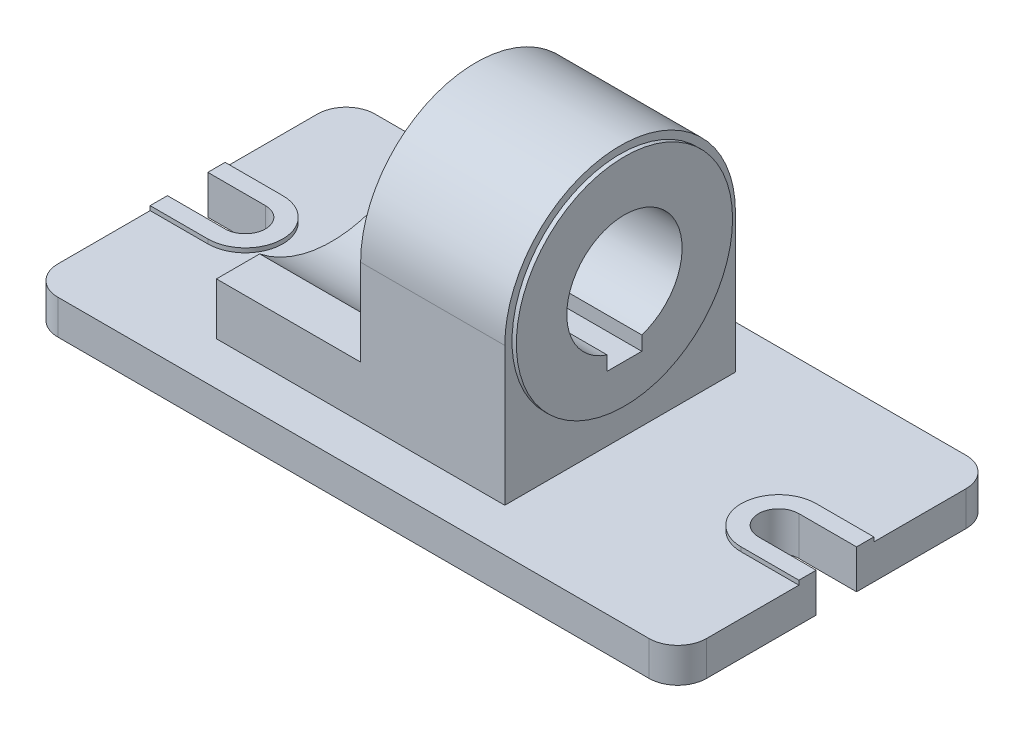
from build123d import *

# Parameters (mm, degrees)
EXTRUDE_1_DEPTH     = 6
EXTRUDE_2_DEPTH     = 1.5
EXTRUDE_START       = -100
EXTRUDE_3_DEPTH     = 25
SKETCH_4_R          = 37.5
EXTRUDE_4_DEPTH     = 1.5
SKETCH_5_R          = 20
SKETCH_5_W          = 12
SKETCH_5_H          = 8
CUT_EXTRUDE_1_DEPTH = 187.58309141
SKETCH_6_W          = 50
SKETCH_6_H          = 80
EXTRUDE_5_DEPTH     = 1.5
SKETCH_7_W          = 15
SKETCH_7_H          = 16.5
EXTRUDE_6_DEPTH     = 50


with BuildPart() as part:
    # 草图1 → 凸台-拉伸1 (new, symmetric)
    with BuildSketch(Plane(origin=(0, 0, 0), x_dir=(1, 0, 0), z_dir=(0, 1, 0))):
        with BuildLine():
            ThreePointArc((-112.5, -45), (-109.571067812, -52.071067812), (-102.5, -55))
            Line((-102.5, -55), (102.5, -55))
            ThreePointArc((102.5, -55), (109.571067812, -52.071067812), (112.5, -45))
            Line((112.5, -45), (112.5, -7))
            Line((112.5, -7), (92.5, -7))
            ThreePointArc((92.5, -7), (85.5, 0), (92.5, 7))
            Line((92.5, 7), (112.5, 7))
            Line((112.5, 7), (112.5, 45))
            ThreePointArc((112.5, 45), (109.571067812, 52.071067812), (102.5, 55))
            Line((102.5, 55), (-102.5, 55))
            ThreePointArc((-102.5, 55), (-109.571067812, 52.071067812), (-112.5, 45))
            Line((-112.5, 45), (-112.5, 7))
            Line((-112.5, 7), (-92.5, 7))
            ThreePointArc((-92.5, 7), (-85.5, 0), (-92.5, -7))
            Line((-92.5, -7), (-112.5, -7))
            Line((-112.5, -7), (-112.5, -45))
        make_face()
    extrude(amount=EXTRUDE_1_DEPTH, both=True)

    # 草图2 → 凸台-拉伸2 (add, symmetric)
    with BuildSketch(Plane(origin=(0, 6, 0), x_dir=(1, 0, 0), z_dir=(0, 1, 0))):
        with BuildLine():
            Line((-92.5, 13), (-112.5, 13))
            Line((-112.5, 13), (-112.5, 7))
            Line((-112.5, 7), (-92.5, 7))
            ThreePointArc((-92.5, 7), (-85.5, 0), (-92.5, -7))
            Line((-92.5, -7), (-112.5, -7))
            Line((-112.5, -7), (-112.5, -13))
            Line((-112.5, -13), (-92.5, -13))
            ThreePointArc((-92.5, -13), (-79.5, 0), (-92.5, 13))
        make_face()
        with BuildLine():
            Line((112.5, 7), (112.5, 13))
            Line((112.5, 13), (92.5, 13))
            ThreePointArc((92.5, 13), (79.5, 0), (92.5, -13))
            Line((92.5, -13), (112.5, -13))
            Line((112.5, -13), (112.5, -7))
            Line((112.5, -7), (92.5, -7))
            ThreePointArc((92.5, -7), (85.5, 0), (92.5, 7))
            Line((92.5, 7), (112.5, 7))
        make_face()
    extrude(amount=EXTRUDE_2_DEPTH, both=True)

    # 草图3 → 凸台-拉伸3 (add, symmetric)
    with BuildSketch(Plane(origin=(112.5, 0, 0), x_dir=(0, 0, -1), z_dir=(1, 0, 0)).offset(EXTRUDE_START)):
        with BuildLine():
            Line((-40, 6), (40, 6))
            Line((40, 6), (40, 54))
            ThreePointArc((40, 54), (0, 94), (-40, 54))
            Line((-40, 54), (-40, 6))
        make_face()
    extrude(amount=EXTRUDE_3_DEPTH, both=True)

    # 草图4 → 凸台-拉伸4 (add, symmetric)
    with BuildSketch(Plane(origin=(37.5, 0, 0), x_dir=(0, 0, -1), z_dir=(1, 0, 0))):
        with Locations((0, 54)):
            Circle(SKETCH_4_R)
    extrude(amount=EXTRUDE_4_DEPTH, both=True)

    # 草图5 → 切除-拉伸1 (cut, through all)
    with BuildSketch(Plane(origin=(39, 0, 0), x_dir=(0, 0, -1), z_dir=(1, 0, 0))):
        with Locations((0, 54)):
            Circle(SKETCH_5_R)
        with Locations((0, 34)):
            Rectangle(SKETCH_5_W, SKETCH_5_H)
    extrude(amount=-CUT_EXTRUDE_1_DEPTH, mode=Mode.SUBTRACT)

    # 草图6 → 凸台-拉伸5 (add, symmetric)
    with BuildSketch(Plane(origin=(0, 6, 0), x_dir=(1, 0, 0), z_dir=(0, 1, 0))):
        with Locations((-37.5, 0)):
            Rectangle(SKETCH_6_W, SKETCH_6_H)
    extrude(amount=EXTRUDE_5_DEPTH, both=True)

    # 草图7 → 凸台-拉伸6 (add)
    with BuildSketch(Plane.ZY.offset(12.5)):
        with BuildLine():
            Line((-25, 24), (-25, 7.5))
            Line((-25, 7.5), (25, 7.5))
            Line((25, 7.5), (25, 24))
            ThreePointArc((25, 24), (0, 15.224989992), (-25, 24))
        make_face()
        with Locations((-32.5, 15.75)):
            Rectangle(SKETCH_7_W, SKETCH_7_H)
        with Locations((32.5, 15.75)):
            Rectangle(SKETCH_7_W, SKETCH_7_H)
    extrude(amount=EXTRUDE_6_DEPTH)


solid = part.part
